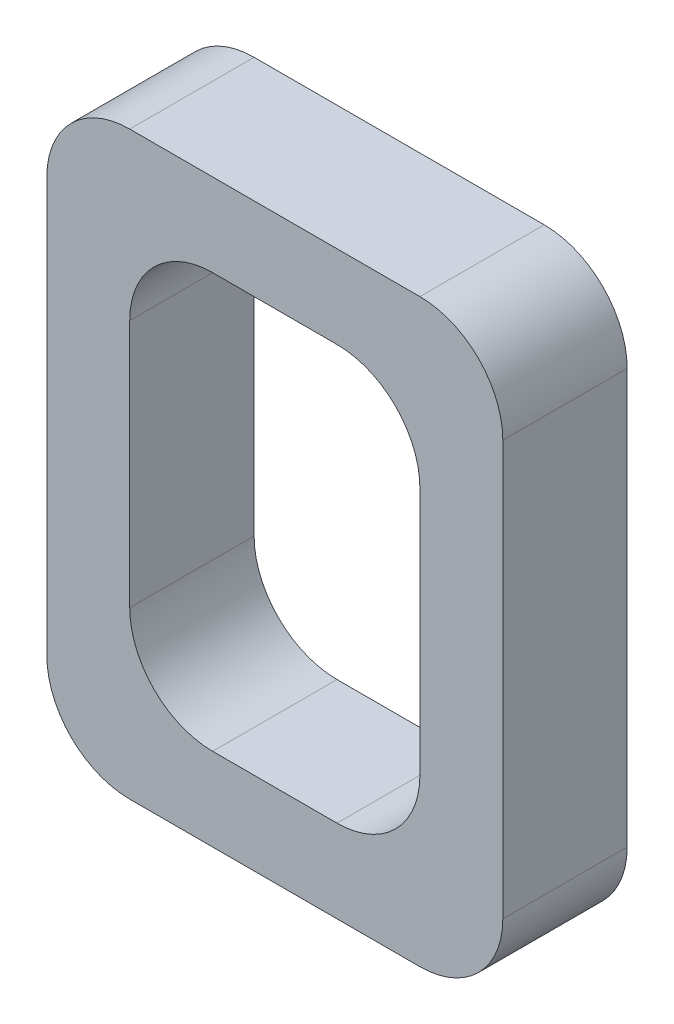
from build123d import *

# Parameters (mm, degrees)
BOSS_EXTRU_1_DEPTH = 15


with BuildPart() as part:
    # Esquisse1 → Boss.-Extru.1 (new body)
    with BuildSketch(Plane.XY):
        with BuildLine():
            Line((-17.5, 35), (17.5, 35))
            ThreePointArc((17.5, 35), (24.571067812, 32.071067812), (27.5, 25))
            Line((27.5, 25), (27.5, -25))
            ThreePointArc((27.5, -25), (24.571067812, -32.071067812), (17.5, -35))
            Line((17.5, -35), (-17.5, -35))
            ThreePointArc((-17.5, -35), (-24.571067812, -32.071067812), (-27.5, -25))
            Line((-27.5, -25), (-27.5, 25))
            ThreePointArc((-27.5, 25), (-24.571067812, 32.071067812), (-17.5, 35))
        make_face()
        with BuildLine():
            Line((-7.5, -25), (7.5, -25))
            ThreePointArc((7.5, -25), (14.571067812, -22.071067812), (17.5, -15))
            Line((17.5, -15), (17.5, 15))
            ThreePointArc((17.5, 15), (14.571067812, 22.071067812), (7.5, 25))
            Line((7.5, 25), (-7.5, 25))
            ThreePointArc((-7.5, 25), (-14.571067812, 22.071067812), (-17.5, 15))
            Line((-17.5, 15), (-17.5, -15))
            ThreePointArc((-17.5, -15), (-14.571067812, -22.071067812), (-7.5, -25))
        make_face(mode=Mode.SUBTRACT)
    extrude(amount=BOSS_EXTRU_1_DEPTH)


solid = part.part
